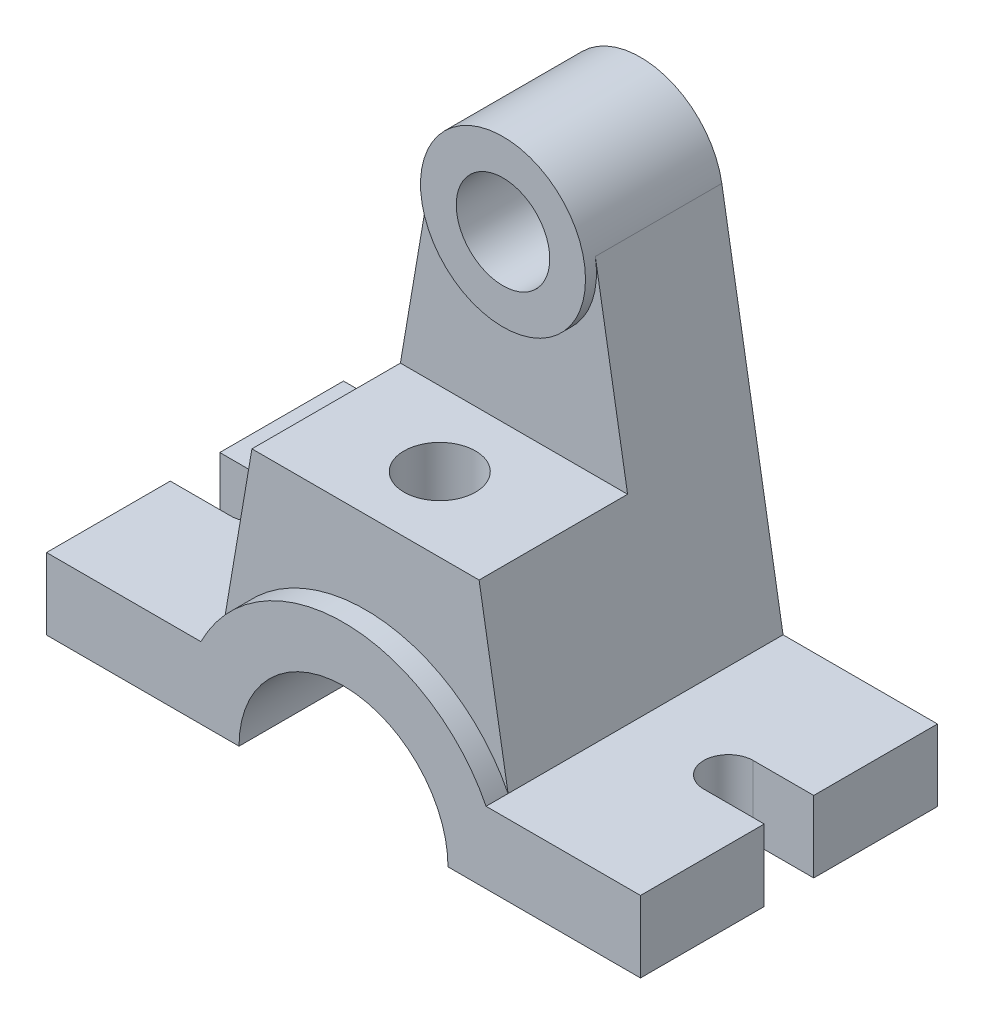
from build123d import *

# Parameters (mm, degrees)
EXTRUDE_1_DEPTH          = 54
EXTRUDE_2_DEPTH          = 50
EXTRUDE_3_DEPTH          = 23
EXTRUDE_4_DEPTH          = 25
CUT_EXTRUDE_1_REACH      = 91.672
CUT_EXTRUDE_1_END_RADIUS = 19
SKETCH_2_R               = 6.5
CUT_EXTRUDE_2_REACH      = 111.16


with BuildPart() as part:
    # 草图1 → 凸台-拉伸1 (new body)
    with BuildSketch(Plane.XY):
        with BuildLine():
            Line((54, 13), (25.922962794, 13))
            ThreePointArc((25.922962794, 13), (15.231546212, 24.677925359), (0, 29))
            Line((0, 29), (0, 19))
            ThreePointArc((0, 19), (13.435028843, 13.435028843), (19, 0))
            Line((19, 0), (54, 0))
            Line((54, 0), (54, 13))
        make_face()
        with BuildLine():
            ThreePointArc((0, 29), (-15.231546212, 24.677925359), (-25.922962794, 13))
            Line((-25.922962794, 13), (-54, 13))
            Line((-54, 13), (-54, 0))
            Line((-54, 0), (-19, 0))
            ThreePointArc((-19, 0), (-13.435028843, 13.435028843), (0, 19))
            Line((0, 19), (0, 29))
        make_face()
    extrude(amount=EXTRUDE_1_DEPTH)

    # 草图1<3> → 凸台-拉伸2 (add)
    with BuildSketch(Plane.XY):
        with BuildLine():
            Line((25.922962794, 13), (20.654024341, 44))
            Line((20.654024341, 44), (0, 44))
            Line((0, 44), (0, 29))
            ThreePointArc((0, 29), (15.231546212, 24.677925359), (25.922962794, 13))
        make_face()
        with BuildLine():
            Line((0, 44), (-20.654024341, 44))
            Line((-20.654024341, 44), (-25.922962794, 13))
            ThreePointArc((-25.922962794, 13), (-15.231546212, 24.677925359), (0, 29))
            Line((0, 29), (0, 44))
        make_face()
    extrude(amount=EXTRUDE_2_DEPTH)

    # 草图1<5> → 凸台-拉伸3 (add)
    with BuildSketch(Plane.XY):
        with BuildLine():
            ThreePointArc((0, 61), (-11.460837745, 66.322748418), (-14.78792136, 78.513440241))
            Line((-14.78792136, 78.513440241), (-20.654024341, 44))
            Line((-20.654024341, 44), (0, 44))
            Line((0, 44), (0, 61))
        make_face()
        with BuildLine():
            Line((20.654024341, 44), (14.78792136, 78.513440241))
            ThreePointArc((14.78792136, 78.513440241), (14.946886305, 77.26118587), (15, 76))
            ThreePointArc((15, 76), (10.606601718, 65.393398282), (0, 61))
            Line((0, 61), (0, 44))
            Line((0, 44), (20.654024341, 44))
        make_face()
    extrude(amount=EXTRUDE_3_DEPTH)

    # 草图1<6> → 凸台-拉伸4 (add)
    with BuildSketch(Plane.XY):
        with BuildLine():
            ThreePointArc((14.78792136, 78.513440241), (9.677251582, 87.460837745), (0, 91))
            Line((0, 91), (0, 84.5))
            ThreePointArc((0, 84.5), (6.01040764, 82.01040764), (8.5, 76))
            ThreePointArc((8.5, 76), (6.01040764, 69.98959236), (0, 67.5))
            Line((0, 67.5), (0, 61))
            ThreePointArc((0, 61), (10.606601718, 65.393398282), (15, 76))
            ThreePointArc((15, 76), (14.946886305, 77.26118587), (14.78792136, 78.513440241))
        make_face()
        with BuildLine():
            Line((0, 84.5), (0, 91))
            ThreePointArc((0, 91), (-9.677251582, 87.460837745), (-14.78792136, 78.513440241))
            ThreePointArc((-14.78792136, 78.513440241), (-11.460837745, 66.322748418), (0, 61))
            Line((0, 61), (0, 67.5))
            ThreePointArc((0, 67.5), (-8.5, 76), (0, 84.5))
        make_face()
    extrude(amount=EXTRUDE_4_DEPTH)

    # 切除-拉伸1: up to this cylinder (the profile starts outside it)
    cut_extrude_1_end = Plane(origin=(0, 0, 36.5), z_dir=(0, 0, -1)) * Cylinder(CUT_EXTRUDE_1_END_RADIUS, 222.344, mode=Mode.PRIVATE)
    # 草图2 → 切除-拉伸1 (cut, up to the surface)
    with BuildSketch(Plane(origin=(0, 44, 0), x_dir=(1, 0, 0), z_dir=(0, 1, 0)), mode=Mode.PRIVATE) as cut_extrude_1_sk1:
        with Locations(Location((0, -36.5, 0), (0, 0, 180))):
            Circle(SKETCH_2_R)
    cut_extrude_1_tool1 = extrude(cut_extrude_1_sk1.sketch, amount=-CUT_EXTRUDE_1_REACH, mode=Mode.PRIVATE) - cut_extrude_1_end
    add(cut_extrude_1_tool1.solids().sort_by_distance((0, 44, 36.5))[0], mode=Mode.SUBTRACT)

    # 草图3 → 切除-拉伸2 (cut, up to next)
    with BuildSketch(Plane(origin=(0, 13, 0), x_dir=(1, 0, 0), z_dir=(0, 1, 0)), mode=Mode.PRIVATE) as cut_extrude_2_sk1:
        with BuildLine():
            Line((-43, -22.5), (-54, -22.5))
            Line((-54, -22.5), (-54, -31.5))
            Line((-54, -31.5), (-43, -31.5))
            ThreePointArc((-43, -31.5), (-38.5, -27), (-43, -22.5))
        make_face()
    cut_extrude_2_tool1 = extrude(cut_extrude_2_sk1.sketch, amount=-CUT_EXTRUDE_2_REACH, mode=Mode.PRIVATE) & part.part
    # 草图3 → 切除-拉伸2 (cut, up to next)
    with BuildSketch(Plane(origin=(0, 13, 0), x_dir=(1, 0, 0), z_dir=(0, 1, 0)), mode=Mode.PRIVATE) as cut_extrude_2_sk2:
        with BuildLine():
            Line((54, -22.5), (54, -31.5))
            Line((54, -31.5), (43, -31.5))
            ThreePointArc((43, -31.5), (38.5, -27), (43, -22.5))
            Line((43, -22.5), (54, -22.5))
        make_face()
    cut_extrude_2_tool2 = extrude(cut_extrude_2_sk2.sketch, amount=-CUT_EXTRUDE_2_REACH, mode=Mode.PRIVATE) & part.part
    add(cut_extrude_2_tool1.solids().sort_by_distance((-46.698151, 13, 27))[0], mode=Mode.SUBTRACT)
    add(cut_extrude_2_tool2.solids().sort_by_distance((46.698151, 13, 27))[0], mode=Mode.SUBTRACT)


solid = part.part
